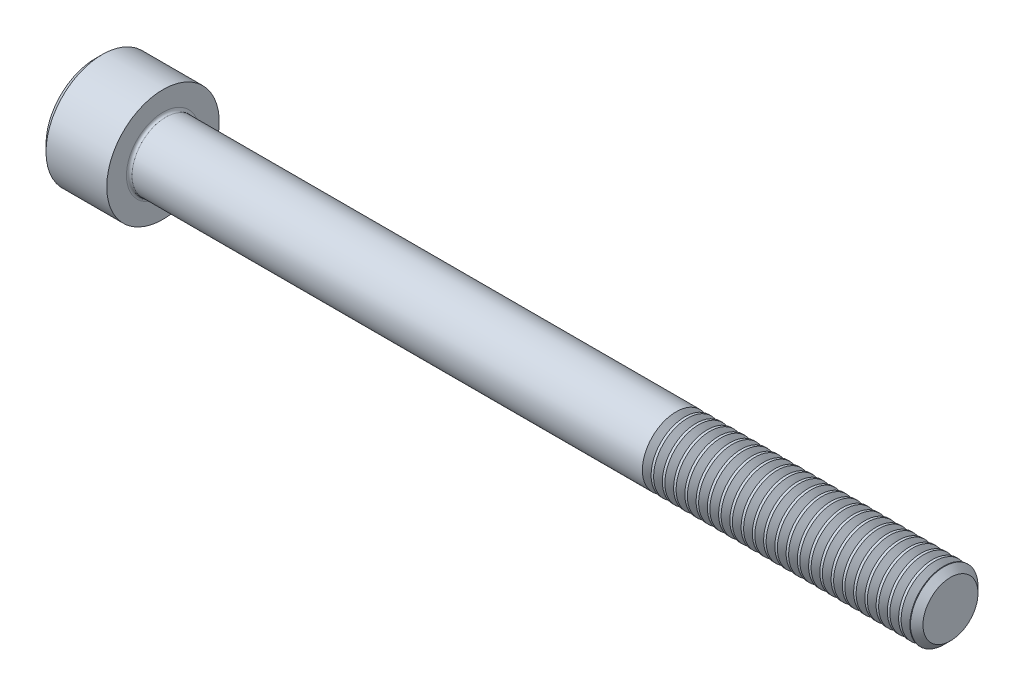
from build123d import *

# Parameters (mm, degrees)
FILLET1_R       = 0.25
HEX_2_DEPTH     = 3
THDSCHPAT_COUNT = 24
THDSCHPAT_PITCH = 1


with BuildPart() as part:
    # BodySke → Base-Revolve (revolve)
    with BuildSketch(Plane.XY, mode=Mode.PRIVATE) as base_revolve_sk:
        Polygon((0, 0), (0, 4.4), (0.6, 5), (6, 5), (6, 3), (75.4455, 3), (76, 2.4455), (76, 0), align=None)
    revolve(base_revolve_sk.sketch.rotate(Axis((-31.75, 0, 0), (1, 0, 0)), 90), axis=Axis((-31.75, 0, 0), (1, 0, 0)))

    # Fillet1
    fillet1_edges = [part.edges().sort_by_distance(p)[0] for p in [
        (6, 0, -3),
    ]]
    fillet(fillet1_edges, radius=FILLET1_R)

    # Sketch2 → Hex-PreBroach (revolve, cut)
    with BuildSketch(Plane.XY, mode=Mode.PRIVATE) as hex_prebroach_sk:
        Polygon((0, 2.542), (3, 2.542), (4.467624384, 0), (0, 0), align=None)
    revolve(hex_prebroach_sk.sketch.rotate(Axis((0, 0, 0), (1, 0, 0)), 90), axis=Axis((0, 0, 0), (1, 0, 0)), mode=Mode.SUBTRACT)

    # Sketch3 → Hex 2 (cut)
    with BuildSketch(Plane(origin=(0, 0, 0), x_dir=(0, 0.500000000000001, 0.866025403784438), z_dir=(-1, 0, 0))):
        Polygon((1.467624384, 2.542), (-1.467624384, 2.542), (-2.935248769, 0), (-1.467624384, -2.542), (1.467624384, -2.542), (2.935248769, 0), align=None)
    extrude(amount=-HEX_2_DEPTH, mode=Mode.SUBTRACT)

    # ThdSchSke → ThreadSchematic (revolve, cut)
    with BuildSketch(Plane.XY):
        Polygon((52, -2.4455), (51.61173492, -3), (51.61173492, -3.75), (52.38826508, -3.75), (52.38826508, -3), align=None)
    threadschematic = revolve(axis=Axis((-3.175, 0, 0), (1, 0, 0)), mode=Mode.SUBTRACT)

    # ThdSchPat: ThreadSchematic ×24
    with Locations(*[(i * THDSCHPAT_PITCH, 0, 0) for i in range(1, THDSCHPAT_COUNT)]):
        add(threadschematic, mode=Mode.SUBTRACT)


solid = part.part
